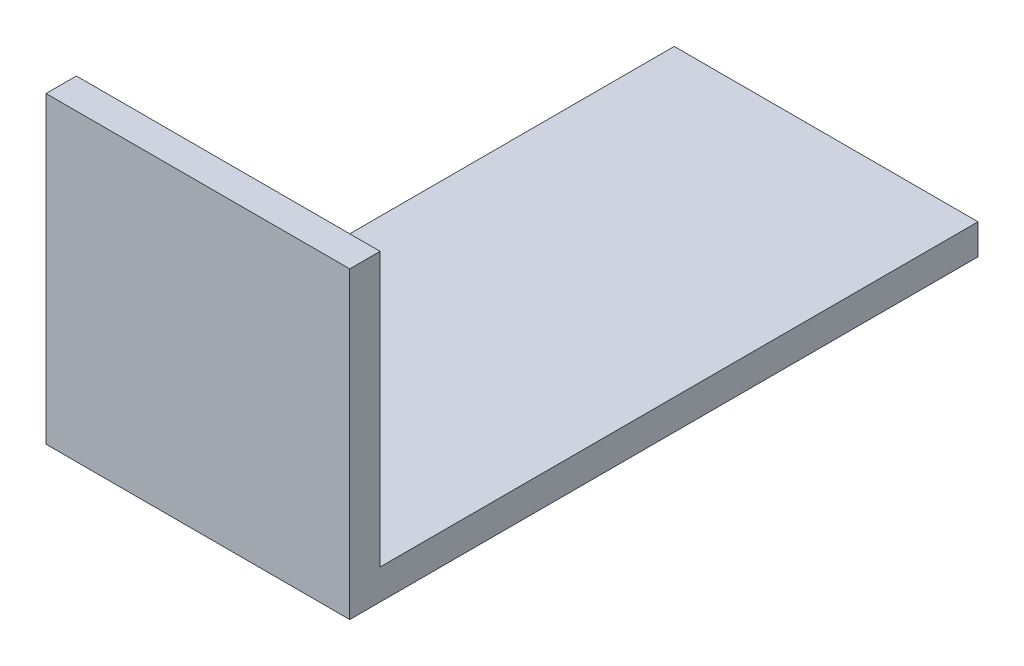
from build123d import *

# Parameters (mm, degrees)
BOSS_EXTRUDE1_DEPTH = 63.5


with BuildPart() as part:
    # Sketch1 → Boss-Extrude1 (new, symmetric)
    with BuildSketch(Plane(origin=(0, 0, 0), x_dir=(0, 0, -1), z_dir=(1, 0, 0))):
        Polygon((0, 0), (250, 0), (250, -12.7), (0, -12.7), (-12.7, -12.7), (-12.7, 114.3), (0, 114.3), align=None)
    extrude(amount=BOSS_EXTRUDE1_DEPTH, both=True)


solid = part.part
